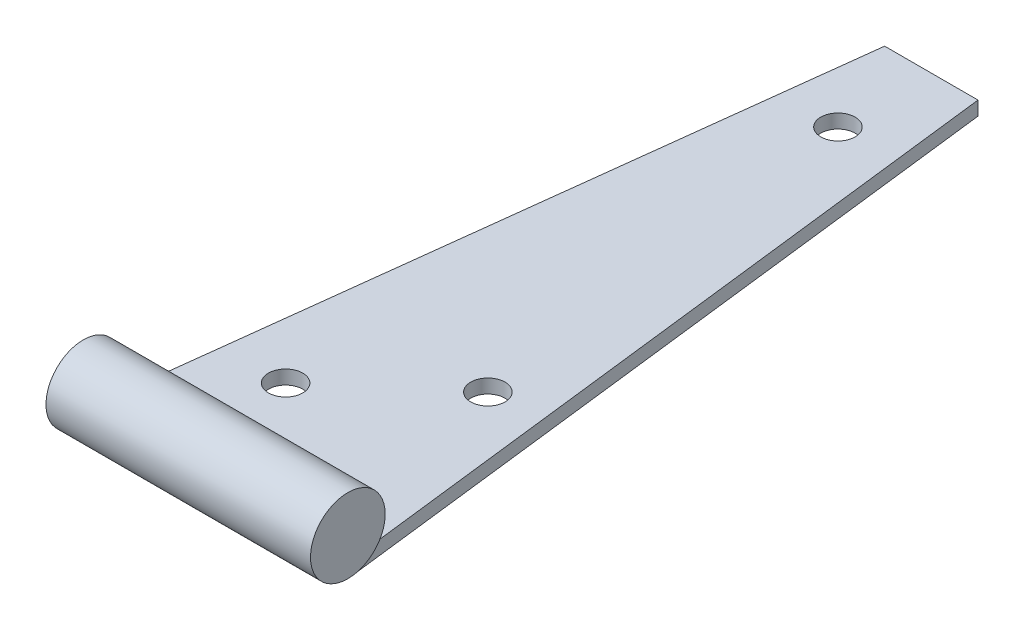
from build123d import *
from build123d.topology import SkipClean

# Parameters (mm, degrees)
BOSS_EXTRUDE1_DEPTH = 1.4224
SKETCH2_R           = 3.81
BOSS_EXTRUDE2_DEPTH = 26.9875
SKETCH3_R           = 1.7526
CUT_EXTRUDE1_DEPTH  = 1.4224


with BuildPart() as part:
    # Sketch1 → Boss-Extrude1 (new body)
    with BuildSketch(Plane(origin=(0, 0, 0), x_dir=(1, 0, 0), z_dir=(0, 1, 0))):
        Polygon((0, 0), (26.9875, 0), (18.25625, 73.025), (8.73125, 73.025), align=None)
    extrude(amount=BOSS_EXTRUDE1_DEPTH)

    # Sketch2 → Boss-Extrude2 (add)
    with SkipClean():  # the faces are left unmerged after this step: merging them gives an invalid solid
        with BuildSketch(Plane(origin=(0, 0, 0), x_dir=(0, 0, -1), z_dir=(1, 0, 0))):
            with Locations((0, 3.81)):
                Circle(SKETCH2_R)
        extrude(amount=BOSS_EXTRUDE2_DEPTH)

    # Sketch3 → Cut-Extrude1 (cut)
    with SkipClean():  # the faces are left unmerged after this step: merging them gives an invalid solid
        with BuildSketch(Plane(origin=(0, 1.4224, 0), x_dir=(1, 0, 0), z_dir=(0, 1, 0))):
            with Locations(Location((13.49375, 63.5, 0), (0, 0, 270))):
                Circle(SKETCH3_R)
            with Locations(Location((7.9375, 12.7, 0), (0, 0, 270))):
                Circle(SKETCH3_R)
            with Locations(Location((19.05, 22.225, 0), (0, 0, 270))):
                Circle(SKETCH3_R)
        extrude(amount=-CUT_EXTRUDE1_DEPTH, mode=Mode.SUBTRACT)


solid = part.part
